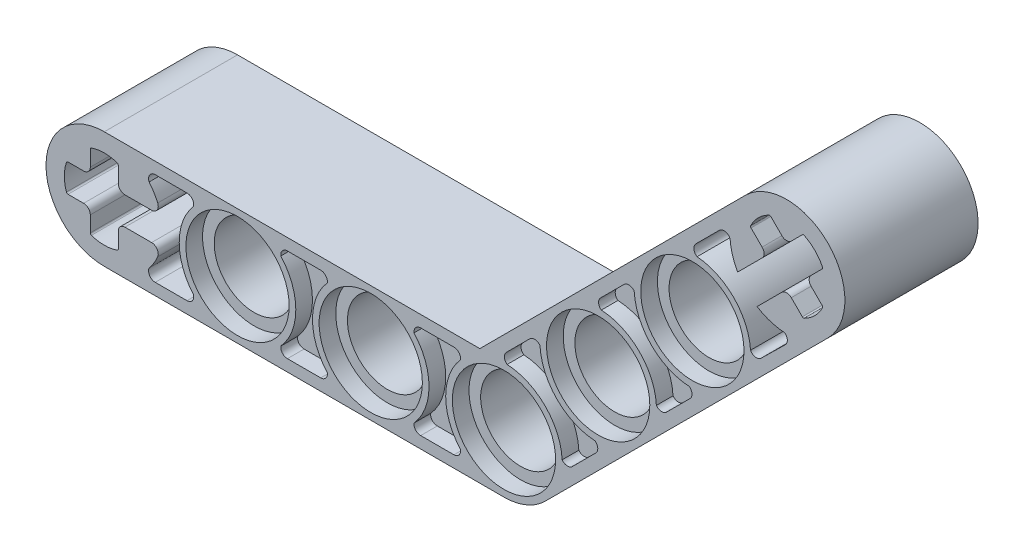
from build123d import *

# Parameters (mm, degrees)
BOSS_EXTRUDE1_DEPTH  = 8
SKETCH3_R            = 2.4
CUT_EXTRUDE1_DEPTH   = 8
CUT_EXTRUDE2_DEPTH   = 40.209455294
SKETCH5_R            = 2.4
CUT_EXTRUDE3_DEPTH   = 40.209455294
SKETCH6_R            = 3.1
CUT_EXTRUDE4_DEPTH   = 1
CUT_EXTRUDE6_DEPTH   = 40.209455294
CUT_EXTRUDE7_DEPTH   = 1
LPATTERN1_COUNT      = 2
LPATTERN1_PITCH      = 8
CUT_EXTRUDE8_DEPTH   = 1
CUT_EXTRUDE9_DEPTH   = 1
CUT_EXTRUDE11_DEPTH  = 52.515832044
CUT_EXTRUDE12_DEPTH  = 40.209455294
MIRROR1_COPY_1_DEPTH = 1
FILLET1_R            = 0.4
FILLET2_R            = 0.4
FILLET3_R            = 0.4
FILLET4_R            = 0.4
FILLET5_R            = 0.4
FILLET6_R            = 0.4
FILLET7_R            = 0.4
FILLET8_R            = 0.4
FILLET9_R            = 0.4
FILLET10_R           = 0.4
FILLET11_R           = 0.1
FILLET12_R           = 0.1
FILLET13_R           = 0.1
FILLET14_R           = 0.1
FILLET15_R           = 0.1
FILLET16_R           = 0.1
FILLET17_R           = 0.1
FILLET18_R           = 0.1
FILLET19_R           = 0.1
FILLET20_R           = 0.1
FILLET21_R           = 0.1
FILLET22_R           = 0.1


with BuildPart() as part:
    # Sketch2 → Boss-Extrude1 (new body)
    with BuildSketch(Plane.XY):
        with BuildLine():
            Line((-12, 3.5), (10.550252532, 3.5))
            Line((10.550252532, 3.5), (26.495689014, 19.445436483))
            ThreePointArc((26.495689014, 19.445436483), (31.445436483, 19.445436483), (31.445436483, 14.495689014))
            Line((31.445436483, 14.495689014), (14.474873734, -2.474873734))
            ThreePointArc((14.474873734, -2.474873734), (13.339392013, -3.233578364), (12, -3.5))
            Line((12, -3.5), (-12, -3.5))
            ThreePointArc((-12, -3.5), (-15.5, 0), (-12, 3.5))
        make_face()
    extrude(amount=-BOSS_EXTRUDE1_DEPTH)

    # Sketch3 → Cut-Extrude1 (cut)
    with BuildSketch(Plane.XY):
        with Locations((-4, 0)):
            Circle(SKETCH3_R)
        with Locations((4, 0)):
            Circle(SKETCH3_R)
        with Locations((12, 0)):
            Circle(SKETCH3_R)
    extrude(amount=-CUT_EXTRUDE1_DEPTH, mode=Mode.SUBTRACT)

    # Sketch4 → Cut-Extrude2 (cut, through all)
    with BuildSketch(Plane.XY):
        with BuildLine():
            Line((-11.16, -0.84), (-9.751800721, -0.84))
            ThreePointArc((-9.751800721, -0.84), (-9.6, 0), (-9.751800721, 0.84))
            Line((-9.751800721, 0.84), (-11.16, 0.84))
            Line((-11.16, 0.84), (-11.16, 2.248199279))
            ThreePointArc((-11.16, 2.248199279), (-12, 2.4), (-12.84, 2.248199279))
            Line((-12.84, 2.248199279), (-12.84, 0.84))
            Line((-12.84, 0.84), (-14.248199279, 0.84))
            ThreePointArc((-14.248199279, 0.84), (-14.4, 0), (-14.248199279, -0.84))
            Line((-14.248199279, -0.84), (-12.84, -0.84))
            Line((-12.84, -0.84), (-12.84, -2.248199279))
            ThreePointArc((-12.84, -2.248199279), (-12, -2.4), (-11.16, -2.248199279))
            Line((-11.16, -2.248199279), (-11.16, -0.84))
        make_face()
    extrude(amount=-CUT_EXTRUDE2_DEPTH, mode=Mode.SUBTRACT)

    # Sketch5 → Cut-Extrude3 (cut, through all)
    with BuildSketch(Plane.XY):
        with Locations((17.656854249, 5.656854249)):
            Circle(SKETCH5_R)
        with Locations((23.313708499, 11.313708499)):
            Circle(SKETCH5_R)
    extrude(amount=-CUT_EXTRUDE3_DEPTH, mode=Mode.SUBTRACT)

    # Sketch6 → Cut-Extrude4 (cut)
    with BuildSketch(Plane.XY):
        with Locations((-4, 0)):
            Circle(SKETCH6_R)
        with Locations((4, 0)):
            Circle(SKETCH6_R)
        with Locations((12, 0)):
            Circle(SKETCH6_R)
        with Locations((17.656854249, 5.656854249)):
            Circle(SKETCH6_R)
        with Locations((23.313708499, 11.313708499)):
            Circle(SKETCH6_R)
    cut_extrude4 = extrude(amount=-CUT_EXTRUDE4_DEPTH, mode=Mode.SUBTRACT)

    # Sketch7 → Cut-Extrude6 (cut, through all)
    with BuildSketch(Plane.XY):
        with BuildLine():
            Line((-9.751800721, 0.84), (-8.602294892, 0.84))
            ThreePointArc((-8.602294892, 0.84), (-8.875721227, 1.577619138), (-9.306979482, 2.235540312))
            ThreePointArc((-9.306979482, 2.235540312), (-9.278346214, 2.617043918), (-8.94235226, 2.8))
            Line((-8.94235226, 2.8), (-7.032381359, 2.8))
            ThreePointArc((-7.032381359, 2.8), (-6.712497982, 2.640155419), (-6.648272727, 2.288373126))
            ThreePointArc((-6.648272727, 2.288373126), (-7.5, 0), (-6.648272727, -2.288373126))
            ThreePointArc((-6.648272727, -2.288373126), (-6.712497982, -2.640155419), (-7.032381359, -2.8))
            Line((-7.032381359, -2.8), (-8.94235226, -2.8))
            ThreePointArc((-8.94235226, -2.8), (-9.278346214, -2.617043918), (-9.306979482, -2.235540312))
            ThreePointArc((-9.306979482, -2.235540312), (-8.875721227, -1.577619138), (-8.602294892, -0.84))
            Line((-8.602294892, -0.84), (-9.751800721, -0.84))
            Line((-9.751800721, -0.84), (-9.751800721, 0.84))
        make_face()
    extrude(amount=-CUT_EXTRUDE6_DEPTH, mode=Mode.SUBTRACT)

    # Sketch9 → Cut-Extrude7 (cut)
    with BuildSketch(Plane.XY):
        with BuildLine():
            Line((-1.003748861, 2.8), (0.996251139, 2.8))
            ThreePointArc((0.996251139, 2.8), (1.302026219, 2.657879043), (1.390516063, 2.332508003))
            ThreePointArc((1.390516063, 2.332508003), (0.5, 0), (1.390516063, -2.332508003))
            ThreePointArc((1.390516063, -2.332508003), (1.302026219, -2.657879043), (0.996251139, -2.8))
            Line((0.996251139, -2.8), (-1.003748861, -2.8))
            ThreePointArc((-1.003748861, -2.8), (-1.306189337, -2.661781891), (-1.399616059, -2.342648792))
            ThreePointArc((-1.399616059, -2.342648792), (-0.5, 0), (-1.399616059, 2.342648792))
            ThreePointArc((-1.399616059, 2.342648792), (-1.306189337, 2.661781891), (-1.003748861, 2.8))
        make_face()
    cut_extrude7 = extrude(amount=-CUT_EXTRUDE7_DEPTH, mode=Mode.SUBTRACT)

    # LPattern1: Cut-Extrude7 ×2
    with Locations(*[(i * LPATTERN1_PITCH, 0, 0) for i in range(1, LPATTERN1_COUNT)]):
        add(cut_extrude7, mode=Mode.SUBTRACT)

    # Sketch10 → Cut-Extrude8 (cut)
    with BuildSketch(Plane.XY):
        with BuildLine():
            Line((12.141421356, 4.101219331), (13.555634919, 5.515432893))
            ThreePointArc((13.555634919, 5.515432893), (13.869755631, 5.631365414), (14.161959815, 5.467875703))
            ThreePointArc((14.161959815, 5.467875703), (15.181980515, 3.181980515), (17.467875703, 2.161959815))
            ThreePointArc((17.467875703, 2.161959815), (17.631365414, 1.869755631), (17.515432893, 1.555634919))
            Line((17.515432893, 1.555634919), (16.101219331, 0.141421356))
            ThreePointArc((16.101219331, 0.141421356), (15.787098619, 0.025488835), (15.494894435, 0.188978547))
            ThreePointArc((15.494894435, 0.188978547), (14.474873734, 2.474873734), (12.188978547, 3.494894435))
            ThreePointArc((12.188978547, 3.494894435), (12.025488835, 3.787098619), (12.141421356, 4.101219331))
        make_face()
    cut_extrude8 = extrude(amount=-CUT_EXTRUDE8_DEPTH, mode=Mode.SUBTRACT)

    # Sketch11 → Cut-Extrude9 (cut)
    with BuildSketch(Plane.XY):
        with BuildLine():
            Line((17.798275606, 9.75807358), (19.212489168, 11.172287143))
            ThreePointArc((19.212489168, 11.172287143), (19.52660988, 11.288219664), (19.818814064, 11.124729952))
            ThreePointArc((19.818814064, 11.124729952), (20.838834765, 8.838834765), (23.124729952, 7.818814064))
            ThreePointArc((23.124729952, 7.818814064), (23.288219664, 7.52660988), (23.172287143, 7.212489168))
            Line((23.172287143, 7.212489168), (21.75807358, 5.798275606))
            ThreePointArc((21.75807358, 5.798275606), (21.443952868, 5.682343085), (21.151748684, 5.845832796))
            ThreePointArc((21.151748684, 5.845832796), (20.131727984, 8.131727984), (17.845832796, 9.151748684))
            ThreePointArc((17.845832796, 9.151748684), (17.682343085, 9.443952868), (17.798275606, 9.75807358))
        make_face()
    cut_extrude9 = extrude(amount=-CUT_EXTRUDE9_DEPTH, mode=Mode.SUBTRACT)

    # Sketch14 → Cut-Extrude11 (cut, through all)
    with BuildSketch(Plane(origin=(20.485281374, -15.514718626, 0), x_dir=(0.7071067811865464, 0.7071067811865488, 0), z_dir=(0, 0, 1))):
        with BuildLine():
            Line((28.130562748, 16.130562748), (28.130562748, 14.722363469))
            ThreePointArc((28.130562748, 14.722363469), (28.970562748, 14.570562748), (29.810562748, 14.722363469))
            Line((29.810562748, 14.722363469), (29.810562748, 16.130562748))
            Line((29.810562748, 16.130562748), (31.218762028, 16.130562748))
            ThreePointArc((31.218762028, 16.130562748), (31.370562748, 16.970562748), (31.218762028, 17.810562748))
            Line((31.218762028, 17.810562748), (29.810562748, 17.810562748))
            Line((29.810562748, 17.810562748), (29.810562748, 19.218762028))
            ThreePointArc((29.810562748, 19.218762028), (28.970562748, 19.370562748), (28.130562748, 19.218762028))
            Line((28.130562748, 19.218762028), (28.130562748, 17.810562748))
            Line((28.130562748, 17.810562748), (26.722363469, 17.810562748))
            Line((26.722363469, 17.810562748), (24.831725497, 17.810562748))
            Line((24.831725497, 17.810562748), (24.831725497, 16.130562748))
            Line((24.831725497, 16.130562748), (26.722363469, 16.130562748))
            Line((26.722363469, 16.130562748), (28.130562748, 16.130562748))
        make_face()
    extrude(amount=-CUT_EXTRUDE11_DEPTH, mode=Mode.SUBTRACT)

    # Sketch15 → Cut-Extrude12 (cut, through all)
    with BuildSketch(Plane.XY):
        with BuildLine():
            Line((23.517476689, 15.429147998), (24.931690252, 16.843361561))
            ThreePointArc((24.931690252, 16.843361561), (25.281079503, 16.954944453), (25.574518259, 16.734905166))
            ThreePointArc((25.574518259, 16.734905166), (26.601846917, 14.485585527), (28.859496379, 13.4766941))
            ThreePointArc((28.859496379, 13.4766941), (29.014014586, 13.184013631), (28.895168657, 12.875123072))
            Line((28.895168657, 12.875123072), (27.440278869, 11.444514798))
            ThreePointArc((27.440278869, 11.444514798), (27.098571648, 11.334445515), (26.806204623, 11.542773609))
            ThreePointArc((26.806204623, 11.542773609), (25.807460949, 13.769558396), (23.596232561, 14.802287028))
            ThreePointArc((23.596232561, 14.802287028), (23.403439362, 15.096443139), (23.517476689, 15.429147998))
        make_face()
    extrude(amount=-CUT_EXTRUDE12_DEPTH, mode=Mode.SUBTRACT)

    # Mirror1: Cut-Extrude4, Cut-Extrude7, Cut-Extrude8, Cut-Extrude9 across plane
    add(cut_extrude4.mirror(Plane.XY.offset(-4)), mode=Mode.SUBTRACT)
    add(cut_extrude7.mirror(Plane.XY.offset(-4)), mode=Mode.SUBTRACT)
    add(cut_extrude8.mirror(Plane.XY.offset(-4)), mode=Mode.SUBTRACT)
    add(cut_extrude9.mirror(Plane.XY.offset(-4)), mode=Mode.SUBTRACT)

    # Mirror1 copy 1 sketch → Mirror1 copy 1 (cut)
    with BuildSketch(Plane(origin=(8, 0, -8), x_dir=(1, 0, 0), z_dir=(0, 0, -1))):
        with BuildLine():
            Line((-1.003748861, -2.8), (0.996251139, -2.8))
            ThreePointArc((0.996251139, -2.8), (1.302026219, -2.657879043), (1.390516063, -2.332508003))
            ThreePointArc((1.390516063, -2.332508003), (0.5, 0), (1.390516063, 2.332508003))
            ThreePointArc((1.390516063, 2.332508003), (1.302026219, 2.657879043), (0.996251139, 2.8))
            Line((0.996251139, 2.8), (-1.003748861, 2.8))
            ThreePointArc((-1.003748861, 2.8), (-1.306189337, 2.661781891), (-1.399616059, 2.342648792))
            ThreePointArc((-1.399616059, 2.342648792), (-0.5, 0), (-1.399616059, -2.342648792))
            ThreePointArc((-1.399616059, -2.342648792), (-1.306189337, -2.661781891), (-1.003748861, -2.8))
        make_face()
    extrude(amount=-MIRROR1_COPY_1_DEPTH, mode=Mode.SUBTRACT)

    # Fillet1
    fillet1_edges = [part.edges().sort_by_distance(p)[0] for p in [
        (-12.84, -0.84, -4),
    ]]
    fillet(fillet1_edges, radius=FILLET1_R)

    # Fillet2
    fillet2_edges = [part.edges().sort_by_distance(p)[0] for p in [
        (-12.84, 0.84, -4),
    ]]
    fillet(fillet2_edges, radius=FILLET2_R)

    # Fillet3
    fillet3_edges = [part.edges().sort_by_distance(p)[0] for p in [
        (-11.16, 0.84, -4),
    ]]
    fillet(fillet3_edges, radius=FILLET3_R)

    # Fillet4
    fillet4_edges = [part.edges().sort_by_distance(p)[0] for p in [
        (-11.16, -0.84, -4),
    ]]
    fillet(fillet4_edges, radius=FILLET4_R)

    # Fillet5
    fillet5_edges = [part.edges().sort_by_distance(p)[0] for p in [
        (-8.602294892, 0.84, -4),
    ]]
    fillet(fillet5_edges, radius=FILLET5_R)

    # Fillet6
    fillet6_edges = [part.edges().sort_by_distance(p)[0] for p in [
        (-8.602294892, -0.84, -4),
    ]]
    fillet(fillet6_edges, radius=FILLET6_R)

    # Fillet7
    fillet7_edges = [part.edges().sort_by_distance(p)[0] for p in [
        (28.970562748, 18.158502141, -4),
    ]]
    fillet(fillet7_edges, radius=FILLET7_R)

    # Fillet8
    fillet8_edges = [part.edges().sort_by_distance(p)[0] for p in [
        (27.782623356, 16.970562748, -4),
    ]]
    fillet(fillet8_edges, radius=FILLET8_R)

    # Fillet9
    fillet9_edges = [part.edges().sort_by_distance(p)[0] for p in [
        (30.158502141, 16.970562748, -4),
    ]]
    fillet(fillet9_edges, radius=FILLET9_R)

    # Fillet10
    fillet10_edges = [part.edges().sort_by_distance(p)[0] for p in [
        (28.970562748, 15.782623356, -4),
    ]]
    fillet(fillet10_edges, radius=FILLET10_R)

    # Fillet11
    fillet11_edges = [part.edges().sort_by_distance(p)[0] for p in [
        (26.786876096, 17.966310008, -4),
    ]]
    fillet(fillet11_edges, radius=FILLET11_R)

    # Fillet12
    fillet12_edges = [part.edges().sort_by_distance(p)[0] for p in [
        (27.974815489, 19.154249401, -4),
    ]]
    fillet(fillet12_edges, radius=FILLET12_R)

    # Fillet13
    fillet13_edges = [part.edges().sort_by_distance(p)[0] for p in [
        (29.966310008, 19.154249401, -4),
    ]]
    fillet(fillet13_edges, radius=FILLET13_R)

    # Fillet14
    fillet14_edges = [part.edges().sort_by_distance(p)[0] for p in [
        (31.154249401, 17.966310008, -4),
    ]]
    fillet(fillet14_edges, radius=FILLET14_R)

    # Fillet15
    fillet15_edges = [part.edges().sort_by_distance(p)[0] for p in [
        (31.154249401, 15.974815489, -4),
    ]]
    fillet(fillet15_edges, radius=FILLET15_R)

    # Fillet16
    fillet16_edges = [part.edges().sort_by_distance(p)[0] for p in [
        (29.966310008, 14.786876096, -4),
    ]]
    fillet(fillet16_edges, radius=FILLET16_R)

    # Fillet17
    fillet17_edges = [part.edges().sort_by_distance(p)[0] for p in [
        (-12.84, 2.248199279, -4),
    ]]
    fillet(fillet17_edges, radius=FILLET17_R)

    # Fillet18
    fillet18_edges = [part.edges().sort_by_distance(p)[0] for p in [
        (-11.16, 2.248199279, -4),
    ]]
    fillet(fillet18_edges, radius=FILLET18_R)

    # Fillet19
    fillet19_edges = [part.edges().sort_by_distance(p)[0] for p in [
        (-12.84, -2.248199279, -4),
    ]]
    fillet(fillet19_edges, radius=FILLET19_R)

    # Fillet20
    fillet20_edges = [part.edges().sort_by_distance(p)[0] for p in [
        (-11.16, -2.248199279, -4),
    ]]
    fillet(fillet20_edges, radius=FILLET20_R)

    # Fillet21
    fillet21_edges = [part.edges().sort_by_distance(p)[0] for p in [
        (-14.248199279, 0.84, -4),
    ]]
    fillet(fillet21_edges, radius=FILLET21_R)

    # Fillet22
    fillet22_edges = [part.edges().sort_by_distance(p)[0] for p in [
        (-14.248199279, -0.84, -4),
    ]]
    fillet(fillet22_edges, radius=FILLET22_R)


solid = part.part
